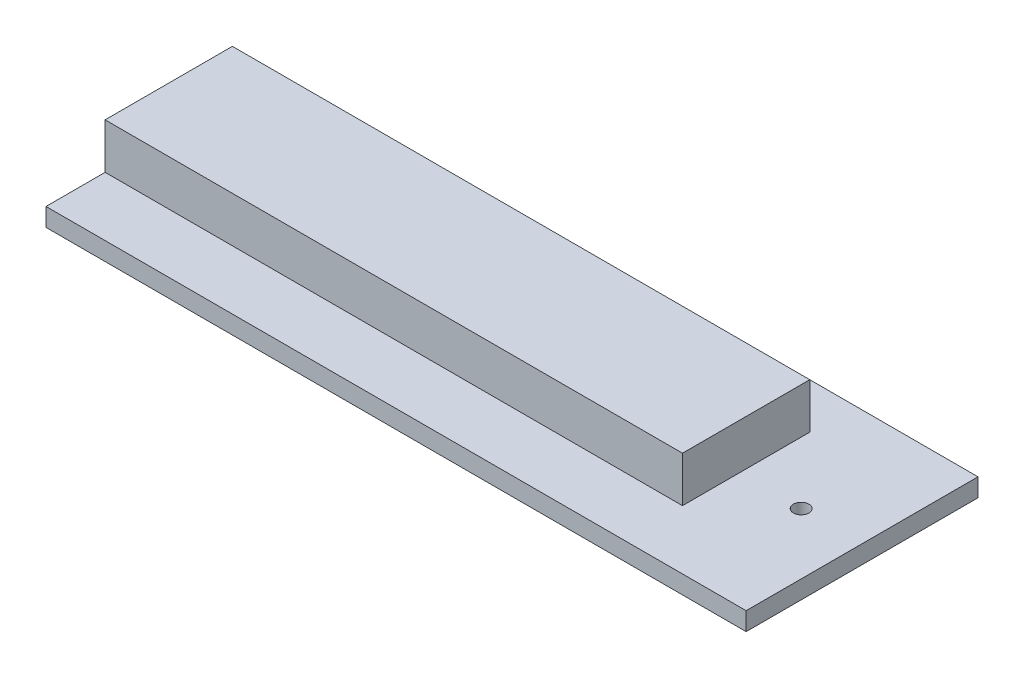
from build123d import *

# Parameters (mm, degrees)
SKETCH1_W           = 154
SKETCH1_H           = 51
SKETCH1_R           = 1.7
BOSS_EXTRUDE1_DEPTH = 4
SKETCH2_W           = 127
SKETCH2_H           = 28
BOSS_EXTRUDE2_DEPTH = 10


with BuildPart() as part:
    # Sketch1 → Boss-Extrude1 (new body)
    with BuildSketch(Plane(origin=(0, 0, 0), x_dir=(1, 0, 0), z_dir=(0, 1, 0))):
        with Locations((77, 25.5)):
            Rectangle(SKETCH1_W, SKETCH1_H)
        with Locations(Location((77, 25.5, 0), (0, 0, 270))):
            Circle(SKETCH1_R, mode=Mode.SUBTRACT)
        with Locations(Location((13.4, 25.5, 0), (0, 0, 270))):
            Circle(SKETCH1_R, mode=Mode.SUBTRACT)
        with Locations(Location((140.6, 25.5, 0), (0, 0, 90))):
            Circle(SKETCH1_R, mode=Mode.SUBTRACT)
    extrude(amount=BOSS_EXTRUDE1_DEPTH)

    # Sketch2 → Boss-Extrude2 (add)
    with BuildSketch(Plane(origin=(0, 4, 0), x_dir=(1, 0, 0), z_dir=(0, 1, 0))):
        with Locations((63.5, 27)):
            Rectangle(SKETCH2_W, SKETCH2_H)
    extrude(amount=BOSS_EXTRUDE2_DEPTH)


solid = part.part
